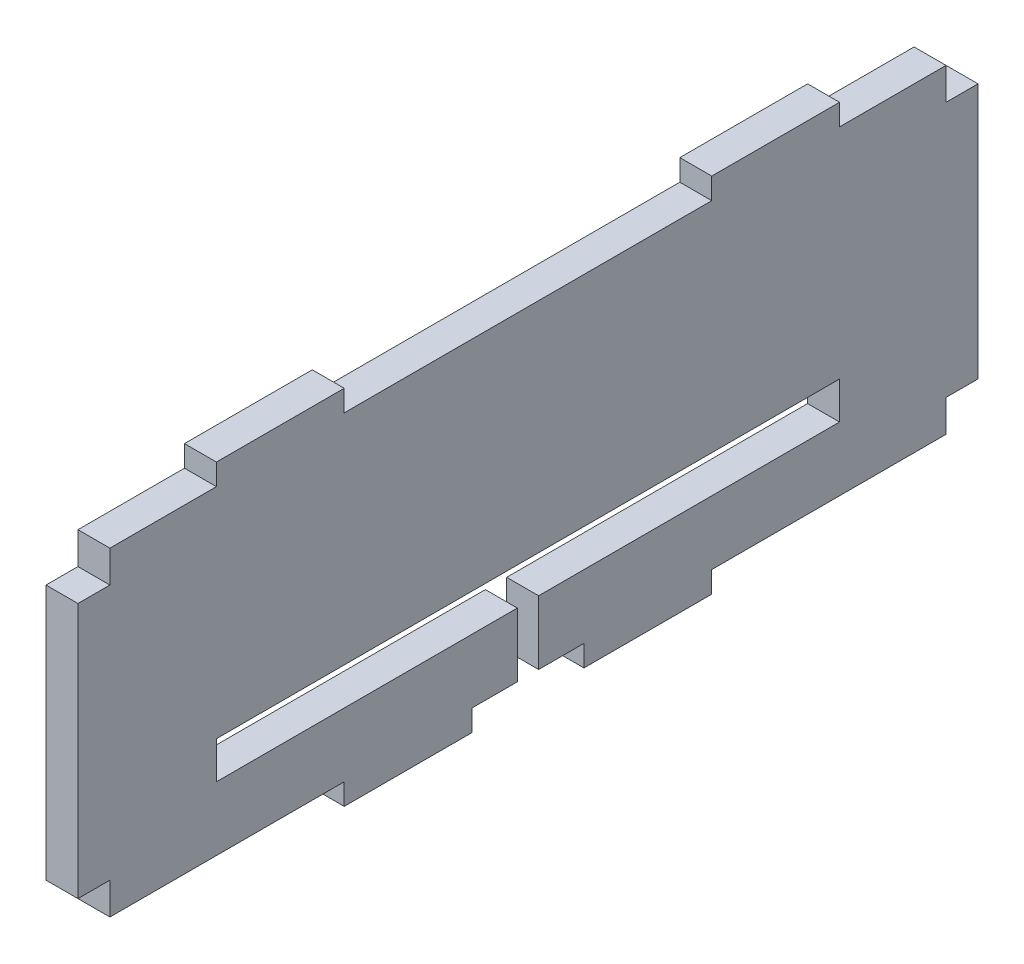
from build123d import *

# Parameters (mm, degrees)
BOSS_EXTRUDE1_DEPTH = 3


with BuildPart() as part:
    # Sketch1 → Boss-Extrude1 (new body)
    with BuildSketch(Plane(origin=(0, 0, 0), x_dir=(0, 0, -1), z_dir=(1, 0, 0))):
        Polygon((25, 2), (25, 0), (37, 0), (37, 2), (41.255, 2), (41.255, 8), (13, 8), (13, 11.5), (71.51, 11.5), (71.51, 8), (43.255, 8), (43.255, 2), (47.51, 2), (47.51, 0), (59.51, 0), (59.51, 2), (81.51, 2), (81.51, 5), (84.51, 5), (84.51, 29), (81.51, 29), (81.51, 32), (71.51, 32), (71.51, 34), (59.51, 34), (59.51, 32), (25, 32), (25, 34), (13, 34), (13, 32), (3, 32), (3, 29), (0, 29), (0, 5), (3, 5), (3, 2), align=None)
    extrude(amount=BOSS_EXTRUDE1_DEPTH)


solid = part.part
